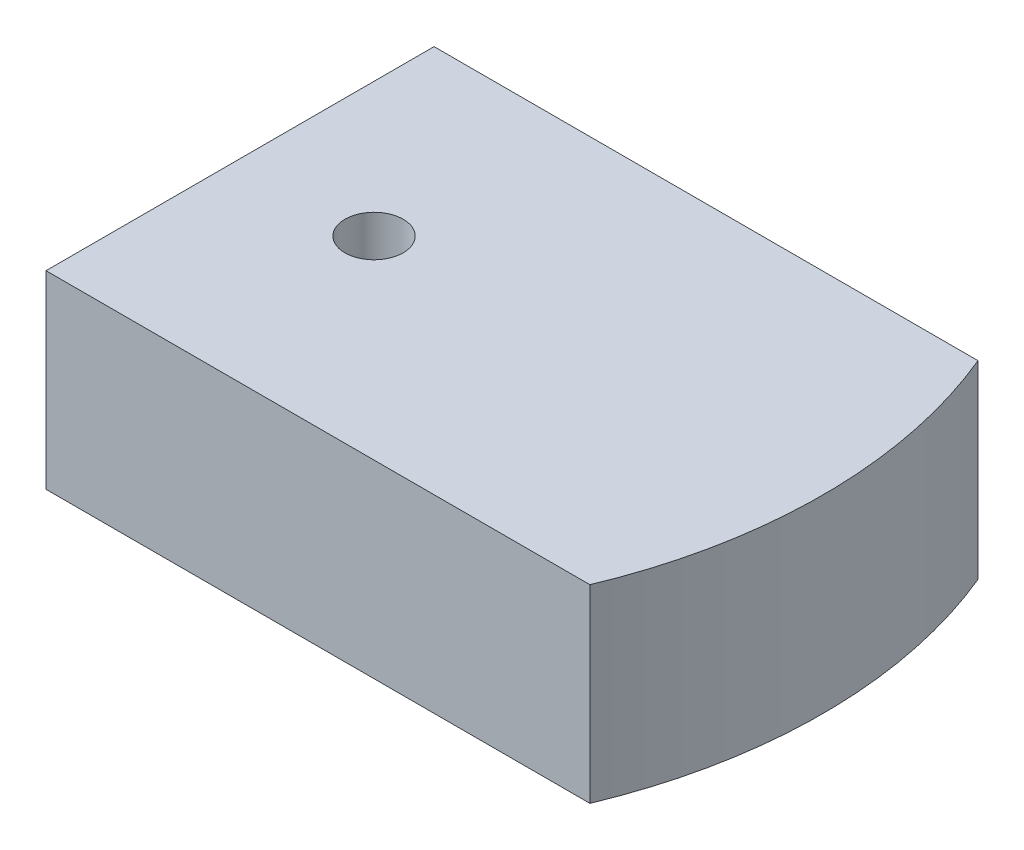
from build123d import *

# Parameters (mm, degrees)
SKETCH1_R           = 1.27
BOSS_EXTRUDE1_DEPTH = 8.255


with BuildPart() as part:
    # Sketch1 → Boss-Extrude1 (new body)
    with BuildSketch(Plane(origin=(0, 0, 0), x_dir=(1, 0, 0), z_dir=(0, 1, 0))):
        with BuildLine():
            Line((0, 8.4582), (23.709911587, 8.4582))
            ThreePointArc((23.709911587, 8.4582), (25.4, 0), (23.709911587, -8.4582))
            Line((23.709911587, -8.4582), (0, -8.4582))
            Line((0, -8.4582), (0, 8.4582))
        make_face()
        with Locations(Location((5.842, 0, 0), (0, 0, 270))):
            Circle(SKETCH1_R, mode=Mode.SUBTRACT)
    extrude(amount=BOSS_EXTRUDE1_DEPTH)


solid = part.part
